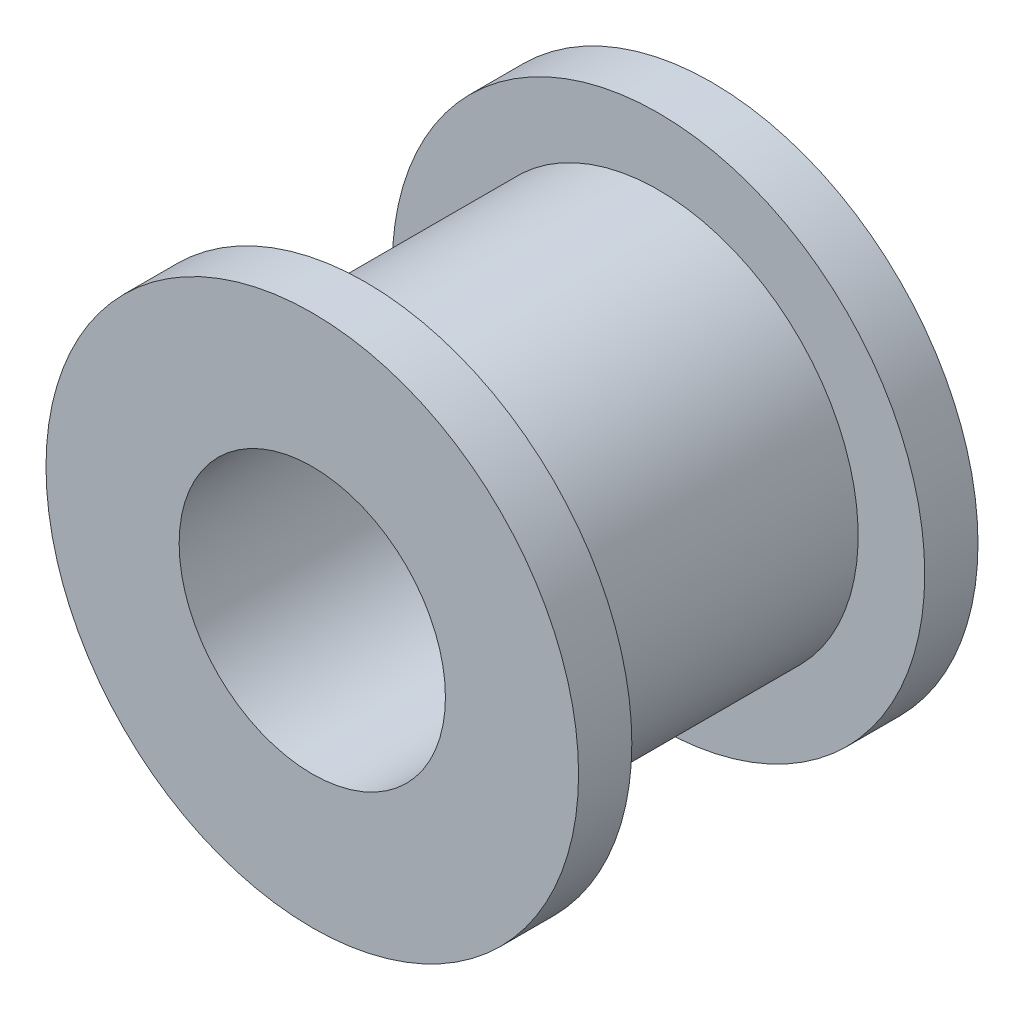
from build123d import *

# Parameters (mm, degrees)
SKETCH1_R           = 7.5
SKETCH1_R_2         = 5
BOSS_EXTRUDE1_DEPTH = 11
SKETCH2_R           = 10
SKETCH2_R_2         = 5
BOSS_EXTRUDE2_DEPTH = 2
BOSS_EXTRUDE3_START = 2
SKETCH3_R           = 10
SKETCH3_R_2         = 5
BOSS_EXTRUDE3_DEPTH = 2


with BuildPart() as part:
    # Sketch1 → Boss-Extrude1 (new body)
    with BuildSketch(Plane.XY):
        Circle(SKETCH1_R)
        Circle(SKETCH1_R_2, mode=Mode.SUBTRACT)
    extrude(amount=BOSS_EXTRUDE1_DEPTH)

    # Sketch2 → Boss-Extrude2 (add)
    with BuildSketch(Plane.XY.offset(11)):
        Circle(SKETCH2_R)
        Circle(SKETCH2_R_2, mode=Mode.SUBTRACT)
    extrude(amount=BOSS_EXTRUDE2_DEPTH)

    # Sketch3 → Boss-Extrude3 (add)
    with BuildSketch(Plane(origin=(0, 0, 0), x_dir=(-1, 0, 0), z_dir=(0, 0, -1)).offset(BOSS_EXTRUDE3_START)):
        with Locations(Location((0, 0, 0), (0, 0, 180))):
            Circle(SKETCH3_R)
        Circle(SKETCH3_R_2, mode=Mode.SUBTRACT)
    extrude(amount=-BOSS_EXTRUDE3_DEPTH)


solid = part.part
